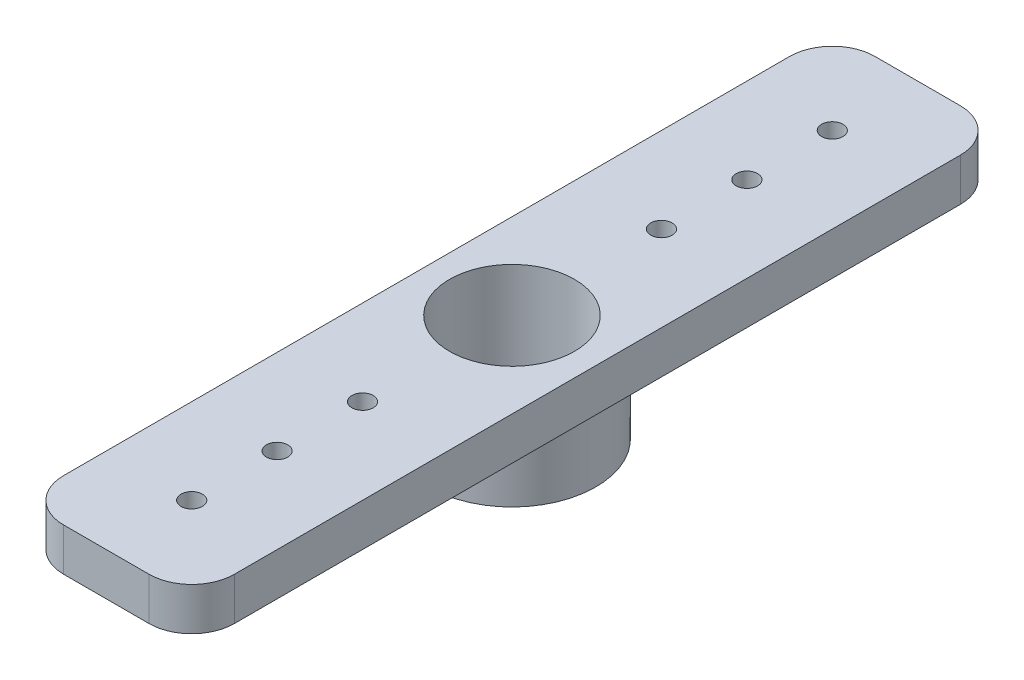
from build123d import *

# Parameters (mm, degrees)
SKETCH1_W           = 8
SKETCH1_H           = 38
BOSS_EXTRUDE1_DEPTH = 2
SKETCH2_R           = 3.925
SKETCH2_R_2         = 2.925
BOSS_EXTRUDE2_DEPTH = 3
CUT_EXTRUDE1_START  = -3
SKETCH3_R           = 2.925
SKETCH3_R_2         = 0.5
CUT_EXTRUDE1_DEPTH  = 3
FILLET3_R           = 2


with BuildPart() as part:
    # Sketch1 → Boss-Extrude1 (new body)
    with BuildSketch(Plane(origin=(0, 0, 0), x_dir=(1, 0, 0), z_dir=(0, 1, 0))):
        with Locations((4, 19)):
            Rectangle(SKETCH1_W, SKETCH1_H)
    extrude(amount=BOSS_EXTRUDE1_DEPTH)

    # Sketch2 → Boss-Extrude2 (add)
    with BuildSketch(Plane.XZ):
        with Locations(Location((4, -19, 0), (0, 0, 270))):
            Circle(SKETCH2_R)
        with Locations(Location((4, -19, 0), (0, 0, 270))):
            Circle(SKETCH2_R_2, mode=Mode.SUBTRACT)
    extrude(amount=BOSS_EXTRUDE2_DEPTH)

    # Sketch3 → Cut-Extrude1 (cut)
    with BuildSketch(Plane.XZ.offset(CUT_EXTRUDE1_START)):
        with Locations(Location((4, -19, 0), (0, 0, 270))):
            Circle(SKETCH3_R)
        with Locations(Location((4, -4, 0), (0, 0, 270))):
            Circle(SKETCH3_R_2)
        with Locations(Location((4, -8, 0), (0, 0, 270))):
            Circle(SKETCH3_R_2)
        with Locations(Location((4, -12, 0), (0, 0, 270))):
            Circle(SKETCH3_R_2)
        with Locations(Location((4, -26, 0), (0, 0, 270))):
            Circle(SKETCH3_R_2)
        with Locations(Location((4, -30, 0), (0, 0, 270))):
            Circle(SKETCH3_R_2)
        with Locations(Location((4, -34, 0), (0, 0, 270))):
            Circle(SKETCH3_R_2)
    extrude(amount=CUT_EXTRUDE1_DEPTH, mode=Mode.SUBTRACT)

    # Fillet3
    fillet3_edges = [part.edges().sort_by_distance(p)[0] for p in [
        (0, 1, -38),
        (8, 1, -38),
        (8, 1, 0),
        (0, 1, 0),
    ]]
    fillet(fillet3_edges, radius=FILLET3_R)


solid = part.part
